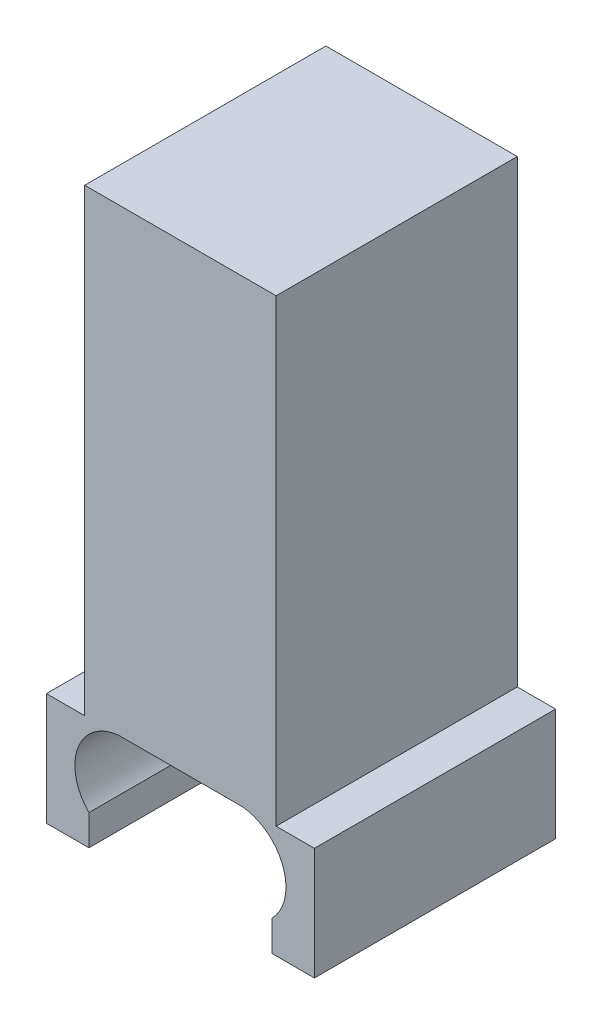
from build123d import *

# Parameters (mm, degrees)
SKETCH1_W               = 31.5
SKETCH1_H               = 60
BOSS_EXTRUDE1_DEPTH     = 12.5
SKETCH2_W               = 5.015
SKETCH2_H               = 40.03
SKETCH2_W_2             = 10
CUT_EXTRUDE1_DEPTH      = 13.765
SKETCH6_R               = 3.25
CUT_EXTRUDE2_DEPTH      = 12
BOSS_EXTRUDE5_DEPTH     = 31.5
BOSS_EXTRUDE6_DEPTH     = 2
CUT_EXTRUDE3_DEPTH      = 61.634148794
CUT_EXTRUDE3_DEPTH_BACK = 61.634148794
SKETCH10_R              = 1.6


with BuildPart() as part:
    # Sketch1 → Boss-Extrude1 (new, symmetric)
    with BuildSketch(Plane(origin=(0, 0, 0), x_dir=(0, 0, -1), z_dir=(1, 0, 0))):
        with Locations((15.75, 20)):
            Rectangle(SKETCH1_W, SKETCH1_H)
    extrude(amount=BOSS_EXTRUDE1_DEPTH, both=True)

    # Sketch2 → Cut-Extrude1 (cut, symmetric)
    with BuildSketch(Plane(origin=(0, 0, -31.5), x_dir=(-1, 0, 0), z_dir=(0, 0, -1))):
        with Locations((7.5075, 20)):
            Rectangle(SKETCH2_W, SKETCH2_H)
        with Locations((0, 20)):
            Rectangle(SKETCH2_W_2, SKETCH2_H)
        with Locations((-7.5075, 20)):
            Rectangle(SKETCH2_W, SKETCH2_H)
    extrude(amount=CUT_EXTRUDE1_DEPTH, both=True, mode=Mode.SUBTRACT)

    # Sketch6 → Cut-Extrude2 (cut)
    with BuildSketch(Plane(origin=(0, 0, -31.5), x_dir=(-1, 0, 0), z_dir=(0, 0, -1))):
        with Locations(Location((-5, 44, 0), (0, 0, 90))):
            Circle(SKETCH6_R)
        with Locations(Location((5, 44, 0), (0, 0, 90))):
            Circle(SKETCH6_R)
        with Locations(Location((5, -4, 0), (0, 0, 90))):
            Circle(SKETCH6_R)
        with Locations(Location((-5, -4, 0), (0, 0, 90))):
            Circle(SKETCH6_R)
    extrude(amount=-CUT_EXTRUDE2_DEPTH, mode=Mode.SUBTRACT)

    # Sketch9 → Boss-Extrude5 (add)
    with BuildSketch(Plane(origin=(0, 0, -31.5), x_dir=(-1, 0, 0), z_dir=(0, 0, -1))):
        with BuildLine():
            Line((11.949417382, -20.681826368), (11.949417382, -24.669417382))
            Line((11.949417382, -24.669417382), (17.5, -24.669417382))
            Line((17.5, -24.669417382), (17.5, -10))
            Line((17.5, -10), (8.113106842, -10))
            ThreePointArc((8.113106842, -10), (13.410384211, -14.127322804), (11.949417382, -20.681826368))
        make_face()
        with BuildLine():
            Line((-17.5, -24.669417382), (-11.949417382, -24.669417382))
            Line((-11.949417382, -24.669417382), (-11.949417382, -20.681826368))
            ThreePointArc((-11.949417382, -20.681826368), (-13.410384211, -14.127322804), (-8.113106842, -10))
            Line((-8.113106842, -10), (-17.5, -10))
            Line((-17.5, -10), (-17.5, -24.669417382))
        make_face()
    extrude(amount=-BOSS_EXTRUDE5_DEPTH)

    # Sketch9<4> → Boss-Extrude6 (add)
    with BuildSketch(Plane(origin=(0, 0, -31.5), x_dir=(-1, 0, 0), z_dir=(0, 0, -1))):
        with BuildLine():
            Line((8.113106842, -10), (-8.113106842, -10))
            ThreePointArc((-8.113106842, -10), (-13.410384211, -14.127322804), (-11.949417382, -20.681826368))
            Line((-11.949417382, -20.681826368), (-11.949417382, -24.669417382))
            Line((-11.949417382, -24.669417382), (11.949417382, -24.669417382))
            Line((11.949417382, -24.669417382), (11.949417382, -20.681826368))
            ThreePointArc((11.949417382, -20.681826368), (13.410384211, -14.127322804), (8.113106842, -10))
        make_face()
    extrude(amount=-BOSS_EXTRUDE6_DEPTH)

    # Sketch10 → Cut-Extrude3 (cut, two sides: drawn at the far end of the back side and taken through both)
    with BuildSketch(Plane.XY.offset(-29.5).offset(-CUT_EXTRUDE3_DEPTH_BACK)):
        with Locations((-7.5, -16.25)):
            Circle(SKETCH10_R)
        with Locations((7.5, -16.25)):
            Circle(SKETCH10_R)
    extrude(amount=CUT_EXTRUDE3_DEPTH + CUT_EXTRUDE3_DEPTH_BACK, mode=Mode.SUBTRACT)


solid = part.part
